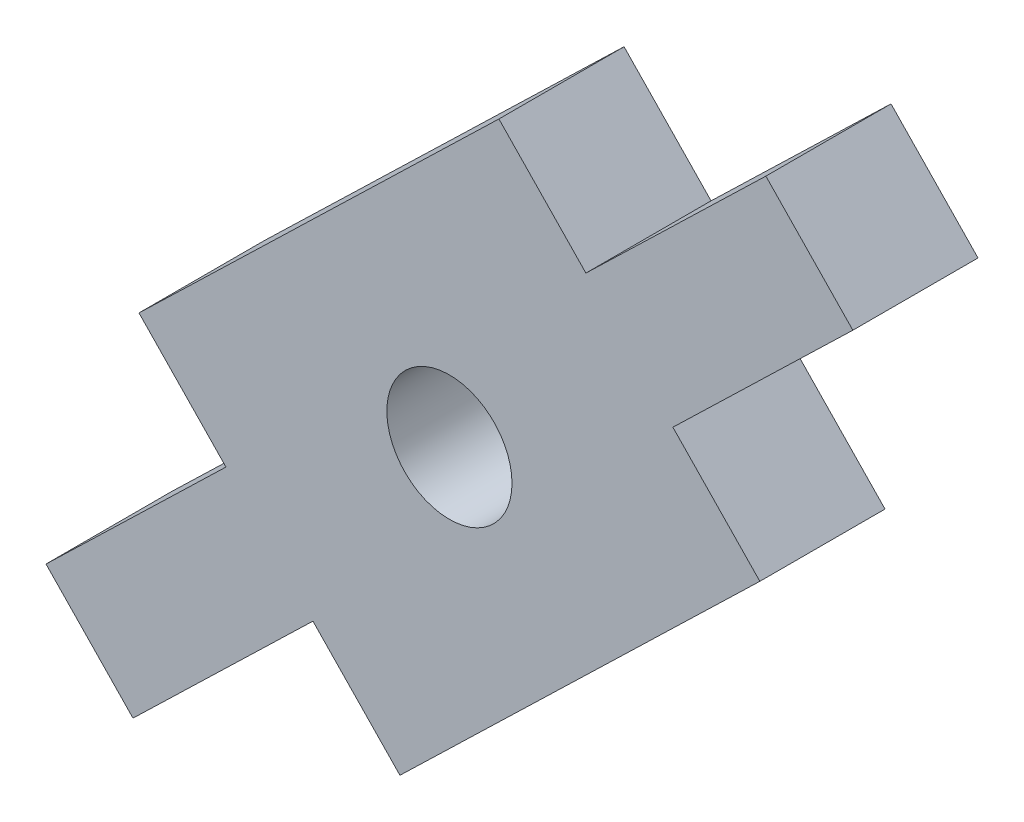
from build123d import *

# Parameters (mm, degrees)
ESQUISSE15_R        = 1.5
BOSS_EXTRU_15_DEPTH = 3


with BuildPart() as part:
    # Esquisse15 → Boss.-Extru.15 (new body)
    with BuildSketch(Plane.XY):
        Polygon((175.079151873, -50.614049322), (183.707012385, -42.27378416), (181.621946095, -40.116819031), (185.935876351, -35.94668645), (183.850810061, -33.789721322), (179.536879804, -37.959853903), (177.451813514, -35.802888775), (168.823953001, -44.143153937), (170.909019292, -46.300119065), (166.595089035, -50.470251647), (168.680155326, -52.627216775), (172.994085582, -48.457084194), align=None)
        with Locations((176.265482693, -43.208469048)):
            Circle(ESQUISSE15_R, mode=Mode.SUBTRACT)
    extrude(amount=BOSS_EXTRU_15_DEPTH)


solid = part.part
